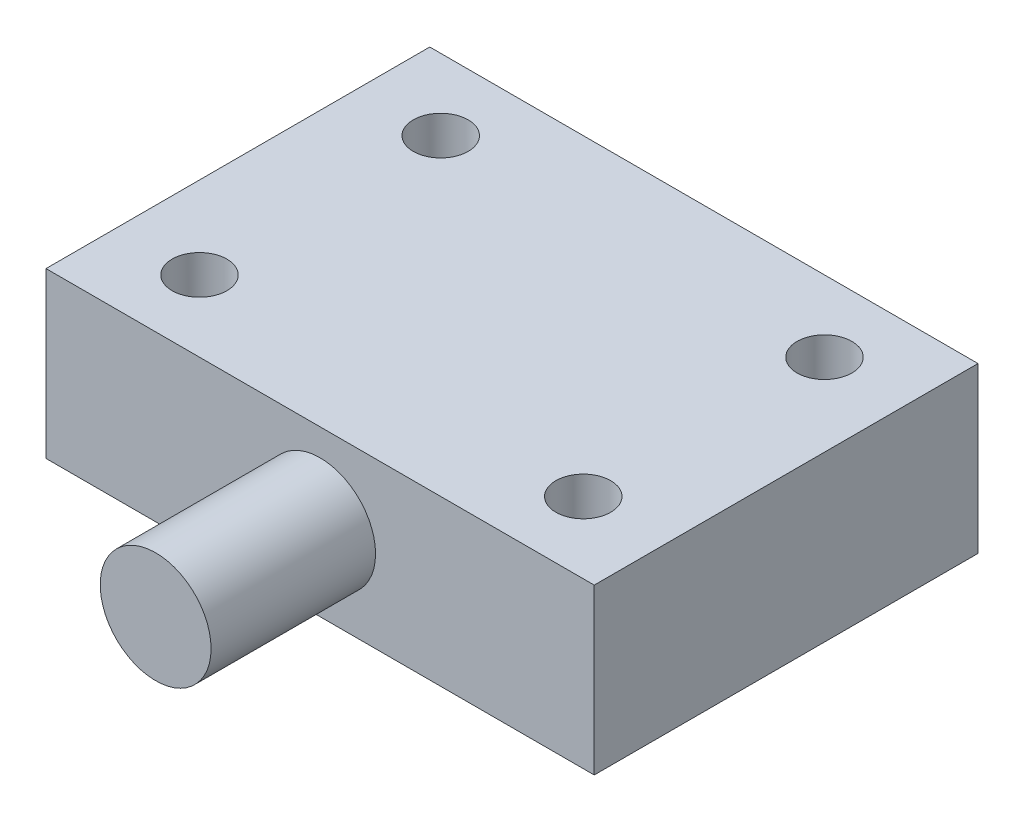
from build123d import *

# Parameters (mm, degrees)
SKETCH1_W           = 50
SKETCH1_H           = 15
BOSS_EXTRUDE1_DEPTH = 35
SKETCH2_R           = 2.5
CUT_EXTRUDE1_DEPTH  = 30
SKETCH3_R           = 5.055
BOSS_EXTRUDE2_DEPTH = 15


with BuildPart() as part:
    # Sketch1 → Boss-Extrude1 (new body)
    with BuildSketch(Plane.XY):
        Rectangle(SKETCH1_W, SKETCH1_H)
    extrude(amount=BOSS_EXTRUDE1_DEPTH)

    # Sketch2 → Cut-Extrude1 (cut)
    with BuildSketch(Plane(origin=(0, 7.5, 0), x_dir=(1, 0, 0), z_dir=(0, 1, 0))):
        with Locations(Location((17.5, -6.5, 0), (0, 0, 270))):
            Circle(SKETCH2_R)
        with Locations(Location((17.5, -28.5, 0), (0, 0, 270))):
            Circle(SKETCH2_R)
        with Locations(Location((-17.5, -28.5, 0), (0, 0, 270))):
            Circle(SKETCH2_R)
        with Locations(Location((-17.5, -6.5, 0), (0, 0, 270))):
            Circle(SKETCH2_R)
    extrude(amount=-CUT_EXTRUDE1_DEPTH, mode=Mode.SUBTRACT)

    # Sketch3 → Boss-Extrude2 (add)
    with BuildSketch(Plane.XY.offset(35)):
        Circle(SKETCH3_R)
    extrude(amount=BOSS_EXTRUDE2_DEPTH)


solid = part.part
